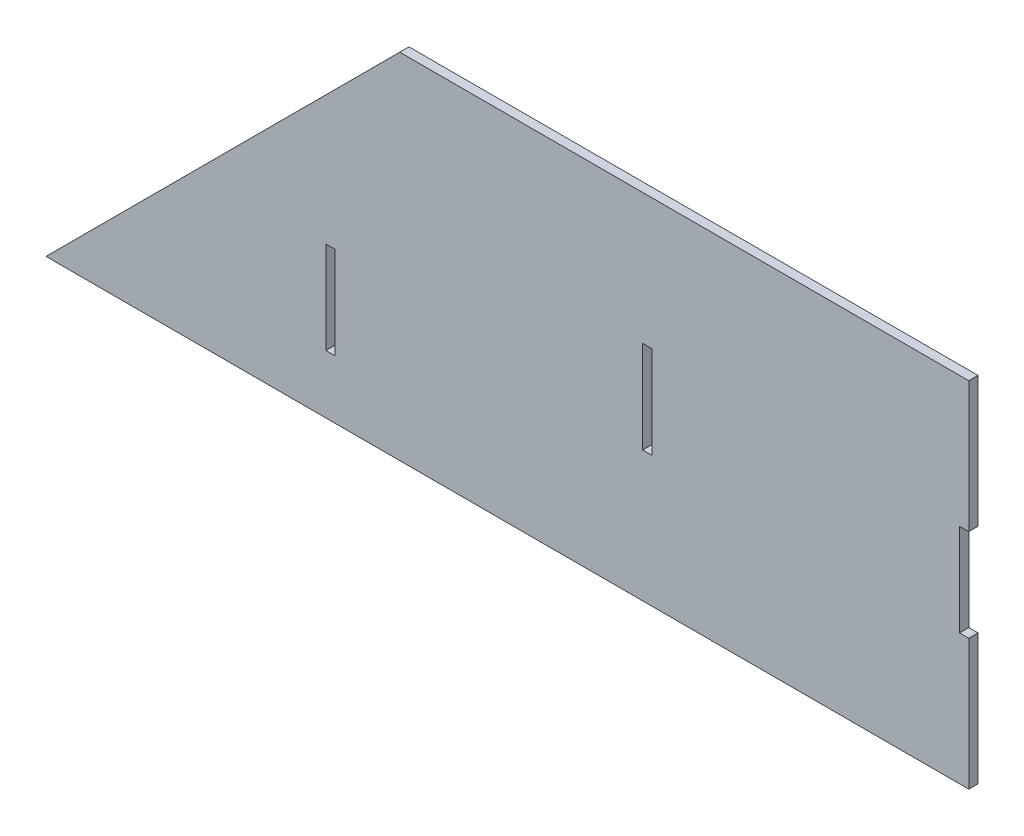
from build123d import *

# Parameters (mm, degrees)
SKETCH1_W           = 3
SKETCH1_H           = 30
BOSS_EXTRUDE1_DEPTH = 3


with BuildPart() as part:
    # Sketch1 → Boss-Extrude1 (new body)
    with BuildSketch(Plane.XY):
        Polygon((300, 42.5), (300, 0), (0, 0), (115, 115), (300, 115), (300, 72.5), (297, 72.5), (297, 42.5), align=None)
        with Locations((195.5, 57.5)):
            Rectangle(SKETCH1_W, SKETCH1_H, mode=Mode.SUBTRACT)
        with Locations((92.5, 33.992083592)):
            Rectangle(SKETCH1_W, SKETCH1_H, mode=Mode.SUBTRACT)
    extrude(amount=BOSS_EXTRUDE1_DEPTH)


solid = part.part
